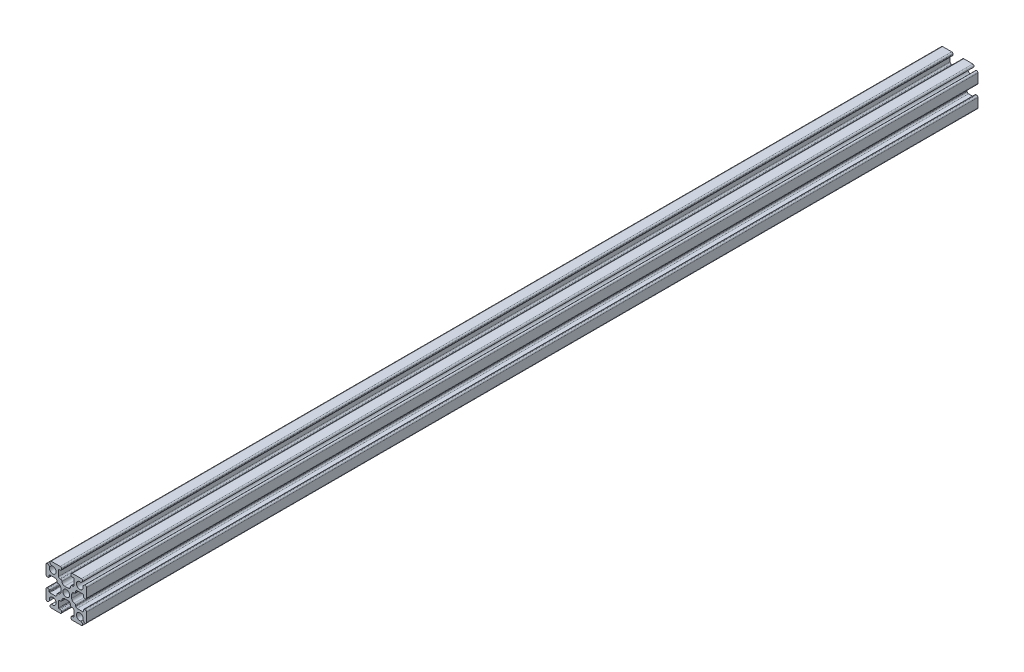
from build123d import *

# Parameters (mm, degrees)
SKETCH1_R           = 1.25
BOSS_EXTRUDE1_DEPTH = 330


with BuildPart() as part:
    # Sketch1 → Boss-Extrude1 (new body)
    with BuildSketch(Plane.XY):
        with BuildLine():
            Line((6.646446609, 5.939339828), (6.163645978, 5.456539197))
            ThreePointArc((6.163645978, 5.456539197), (4.116116524, 4.116116524), (5.456539197, 6.163645978))
            Line((5.456539197, 6.163645978), (5.939339828, 6.646446609))
            ThreePointArc((5.939339828, 6.646446609), (6.047726204, 7.191341716), (5.585786438, 7.5))
            Line((5.585786438, 7.5), (2.25, 7.5))
            ThreePointArc((2.25, 7.5), (1.896446609, 7.353553391), (1.75, 7))
            Line((1.75, 7), (1.75, 6.8))
            ThreePointArc((1.75, 6.8), (1.896446609, 6.446446609), (2.25, 6.3))
            Line((2.25, 6.3), (2.65, 6.3))
            ThreePointArc((2.65, 6.3), (2.791421356, 6.241421356), (2.85, 6.1))
            Line((2.85, 6.1), (2.85, 4))
            ThreePointArc((2.85, 4), (2.703553391, 3.646446609), (2.35, 3.5))
            Line((2.35, 3.5), (2.1, 3.5))
            ThreePointArc((2.1, 3.5), (1.746446609, 3.353553391), (1.6, 3))
            ThreePointArc((1.6, 3), (1.307106781, 2.292893219), (0.6, 2))
            Line((0.6, 2), (-0.6, 2))
            ThreePointArc((-0.6, 2), (-1.307106781, 2.292893219), (-1.6, 3))
            ThreePointArc((-1.6, 3), (-1.746446609, 3.353553391), (-2.1, 3.5))
            Line((-2.1, 3.5), (-2.35, 3.5))
            ThreePointArc((-2.35, 3.5), (-2.703553391, 3.646446609), (-2.85, 4))
            Line((-2.85, 4), (-2.85, 6.1))
            ThreePointArc((-2.85, 6.1), (-2.791421356, 6.241421356), (-2.65, 6.3))
            Line((-2.65, 6.3), (-2.25, 6.3))
            ThreePointArc((-2.25, 6.3), (-1.896446609, 6.446446609), (-1.75, 6.8))
            Line((-1.75, 6.8), (-1.75, 7))
            ThreePointArc((-1.75, 7), (-1.896446609, 7.353553391), (-2.25, 7.5))
            Line((-2.25, 7.5), (-5.585786438, 7.5))
            ThreePointArc((-5.585786438, 7.5), (-6.047726204, 7.191341716), (-5.939339828, 6.646446609))
            Line((-5.939339828, 6.646446609), (-5.456539197, 6.163645978))
            ThreePointArc((-5.456539197, 6.163645978), (-4.116116524, 4.116116524), (-6.163645978, 5.456539197))
            Line((-6.163645978, 5.456539197), (-6.646446609, 5.939339828))
            ThreePointArc((-6.646446609, 5.939339828), (-7.191341716, 6.047726204), (-7.5, 5.585786438))
            Line((-7.5, 5.585786438), (-7.5, 2.25))
            ThreePointArc((-7.5, 2.25), (-7.353553391, 1.896446609), (-7, 1.75))
            Line((-7, 1.75), (-6.8, 1.75))
            ThreePointArc((-6.8, 1.75), (-6.446446609, 1.896446609), (-6.3, 2.25))
            Line((-6.3, 2.25), (-6.3, 2.65))
            ThreePointArc((-6.3, 2.65), (-6.241421356, 2.791421356), (-6.1, 2.85))
            Line((-6.1, 2.85), (-4, 2.85))
            ThreePointArc((-4, 2.85), (-3.646446609, 2.703553391), (-3.5, 2.35))
            Line((-3.5, 2.35), (-3.5, 2.1))
            ThreePointArc((-3.5, 2.1), (-3.353553391, 1.746446609), (-3, 1.6))
            ThreePointArc((-3, 1.6), (-2.292893219, 1.307106781), (-2, 0.6))
            Line((-2, 0.6), (-2, -0.6))
            ThreePointArc((-2, -0.6), (-2.292893219, -1.307106781), (-3, -1.6))
            ThreePointArc((-3, -1.6), (-3.353553391, -1.746446609), (-3.5, -2.1))
            Line((-3.5, -2.1), (-3.5, -2.35))
            ThreePointArc((-3.5, -2.35), (-3.646446609, -2.703553391), (-4, -2.85))
            Line((-4, -2.85), (-6.1, -2.85))
            ThreePointArc((-6.1, -2.85), (-6.241421356, -2.791421356), (-6.3, -2.65))
            Line((-6.3, -2.65), (-6.3, -2.25))
            ThreePointArc((-6.3, -2.25), (-6.446446609, -1.896446609), (-6.8, -1.75))
            Line((-6.8, -1.75), (-7, -1.75))
            ThreePointArc((-7, -1.75), (-7.353553391, -1.896446609), (-7.5, -2.25))
            Line((-7.5, -2.25), (-7.5, -5.585786438))
            ThreePointArc((-7.5, -5.585786438), (-7.191341716, -6.047726204), (-6.646446609, -5.939339828))
            Line((-6.646446609, -5.939339828), (-6.163645978, -5.456539197))
            ThreePointArc((-6.163645978, -5.456539197), (-4.116116524, -4.116116524), (-5.456539197, -6.163645978))
            Line((-5.456539197, -6.163645978), (-5.939339828, -6.646446609))
            ThreePointArc((-5.939339828, -6.646446609), (-6.047726204, -7.191341716), (-5.585786438, -7.5))
            Line((-5.585786438, -7.5), (-2.25, -7.5))
            ThreePointArc((-2.25, -7.5), (-1.896446609, -7.353553391), (-1.75, -7))
            Line((-1.75, -7), (-1.75, -6.8))
            ThreePointArc((-1.75, -6.8), (-1.896446609, -6.446446609), (-2.25, -6.3))
            Line((-2.25, -6.3), (-2.65, -6.3))
            ThreePointArc((-2.65, -6.3), (-2.791421356, -6.241421356), (-2.85, -6.1))
            Line((-2.85, -6.1), (-2.85, -4))
            ThreePointArc((-2.85, -4), (-2.703553391, -3.646446609), (-2.35, -3.5))
            Line((-2.35, -3.5), (-2.1, -3.5))
            ThreePointArc((-2.1, -3.5), (-1.746446609, -3.353553391), (-1.6, -3))
            ThreePointArc((-1.6, -3), (-1.307106781, -2.292893219), (-0.6, -2))
            Line((-0.6, -2), (0.6, -2))
            ThreePointArc((0.6, -2), (1.307106781, -2.292893219), (1.6, -3))
            ThreePointArc((1.6, -3), (1.746446609, -3.353553391), (2.1, -3.5))
            Line((2.1, -3.5), (2.35, -3.5))
            ThreePointArc((2.35, -3.5), (2.703553391, -3.646446609), (2.85, -4))
            Line((2.85, -4), (2.85, -6.1))
            ThreePointArc((2.85, -6.1), (2.791421356, -6.241421356), (2.65, -6.3))
            Line((2.65, -6.3), (2.25, -6.3))
            ThreePointArc((2.25, -6.3), (1.896446609, -6.446446609), (1.75, -6.8))
            Line((1.75, -6.8), (1.75, -7))
            ThreePointArc((1.75, -7), (1.896446609, -7.353553391), (2.25, -7.5))
            Line((2.25, -7.5), (5.585786438, -7.5))
            ThreePointArc((5.585786438, -7.5), (6.047726204, -7.191341716), (5.939339828, -6.646446609))
            Line((5.939339828, -6.646446609), (5.456539197, -6.163645978))
            ThreePointArc((5.456539197, -6.163645978), (4.116116524, -4.116116524), (6.163645978, -5.456539197))
            Line((6.163645978, -5.456539197), (6.646446609, -5.939339828))
            ThreePointArc((6.646446609, -5.939339828), (7.191341716, -6.047726204), (7.5, -5.585786438))
            Line((7.5, -5.585786438), (7.5, -2.25))
            ThreePointArc((7.5, -2.25), (7.353553391, -1.896446609), (7, -1.75))
            Line((7, -1.75), (6.8, -1.75))
            ThreePointArc((6.8, -1.75), (6.446446609, -1.896446609), (6.3, -2.25))
            Line((6.3, -2.25), (6.3, -2.65))
            ThreePointArc((6.3, -2.65), (6.241421356, -2.791421356), (6.1, -2.85))
            Line((6.1, -2.85), (4, -2.85))
            ThreePointArc((4, -2.85), (3.646446609, -2.703553391), (3.5, -2.35))
            Line((3.5, -2.35), (3.5, -2.1))
            ThreePointArc((3.5, -2.1), (3.353553391, -1.746446609), (3, -1.6))
            ThreePointArc((3, -1.6), (2.292893219, -1.307106781), (2, -0.6))
            Line((2, -0.6), (2, 0.6))
            ThreePointArc((2, 0.6), (2.292893219, 1.307106781), (3, 1.6))
            ThreePointArc((3, 1.6), (3.353553391, 1.746446609), (3.5, 2.1))
            Line((3.5, 2.1), (3.5, 2.35))
            ThreePointArc((3.5, 2.35), (3.646446609, 2.703553391), (4, 2.85))
            Line((4, 2.85), (6.1, 2.85))
            ThreePointArc((6.1, 2.85), (6.241421356, 2.791421356), (6.3, 2.65))
            Line((6.3, 2.65), (6.3, 2.25))
            ThreePointArc((6.3, 2.25), (6.446446609, 1.896446609), (6.8, 1.75))
            Line((6.8, 1.75), (7, 1.75))
            ThreePointArc((7, 1.75), (7.353553391, 1.896446609), (7.5, 2.25))
            Line((7.5, 2.25), (7.5, 5.585786438))
            ThreePointArc((7.5, 5.585786438), (7.191341716, 6.047726204), (6.646446609, 5.939339828))
        make_face()
        with Locations(Location((0, 0, 0), (0, 0, 180))):
            Circle(SKETCH1_R, mode=Mode.SUBTRACT)
    extrude(amount=BOSS_EXTRUDE1_DEPTH)


solid = part.part
